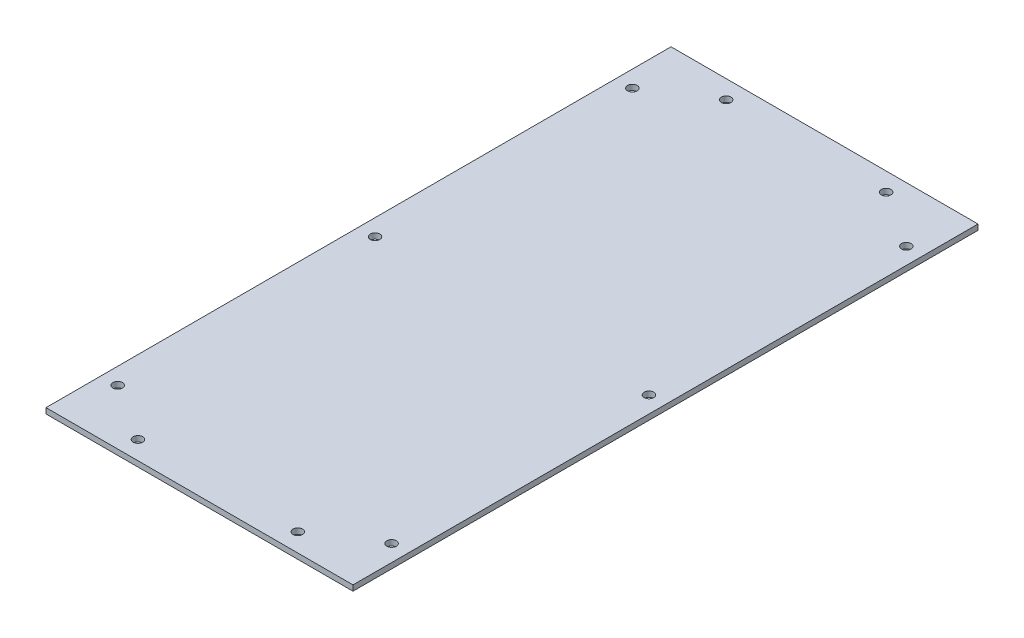
from build123d import *

# Parameters (mm, degrees)
CROQUIS1_W              = 167
CROQUIS1_H              = 340
CROQUIS1_R              = 2.6
SALIENTE_EXTRUIR1_DEPTH = 3


with BuildPart() as part:
    # Croquis1 → Saliente-Extruir1 (new body)
    with BuildSketch(Plane(origin=(0, 0, 0), x_dir=(1, 0, 0), z_dir=(0, 1, 0))):
        Rectangle(CROQUIS1_W, CROQUIS1_H)
        with Locations(Location((-74.5, 140, 0), (0, 0, 270))):
            Circle(CROQUIS1_R, mode=Mode.SUBTRACT)
        with Locations(Location((-74.5, 0, 0), (0, 0, 270))):
            Circle(CROQUIS1_R, mode=Mode.SUBTRACT)
        with Locations(Location((-74.5, -140, 0), (0, 0, 270))):
            Circle(CROQUIS1_R, mode=Mode.SUBTRACT)
        with Locations(Location((74.5, 140, 0), (0, 0, 270))):
            Circle(CROQUIS1_R, mode=Mode.SUBTRACT)
        with Locations(Location((74.5, -140, 0), (0, 0, 270))):
            Circle(CROQUIS1_R, mode=Mode.SUBTRACT)
        with Locations(Location((74.5, 0, 0), (0, 0, 270))):
            Circle(CROQUIS1_R, mode=Mode.SUBTRACT)
        with Locations(Location((-43.5, 160, 0), (0, 0, 270))):
            Circle(CROQUIS1_R, mode=Mode.SUBTRACT)
        with Locations(Location((43.5, 160, 0), (0, 0, 270))):
            Circle(CROQUIS1_R, mode=Mode.SUBTRACT)
        with Locations(Location((-43.5, -160, 0), (0, 0, 270))):
            Circle(CROQUIS1_R, mode=Mode.SUBTRACT)
        with Locations(Location((43.5, -160, 0), (0, 0, 270))):
            Circle(CROQUIS1_R, mode=Mode.SUBTRACT)
    extrude(amount=SALIENTE_EXTRUIR1_DEPTH)


solid = part.part
